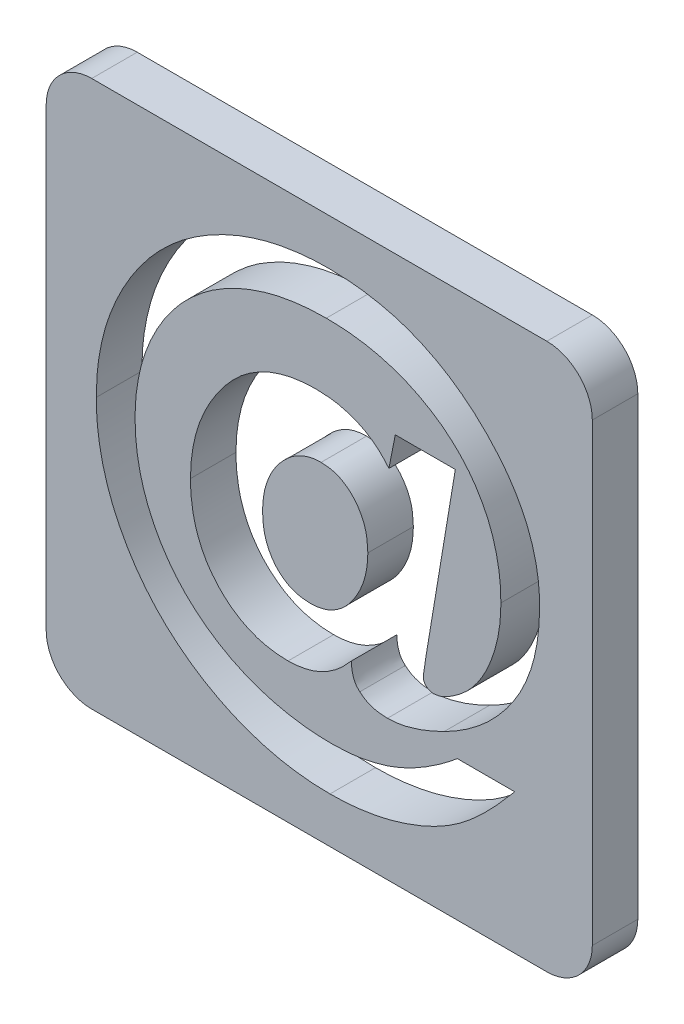
from build123d import *

# Parameters (mm, degrees)
BOSS_EXTRUDE1_DEPTH = 10
CUT_EXTRUDE10_DEPTH = 10


with BuildPart() as part:
    # Sketch1 → Boss-Extrude1 (new body)
    with BuildSketch(Plane.XY):
        with BuildLine():
            Line((-50, 60), (50, 60))
            ThreePointArc((50, 60), (57.071067812, 57.071067812), (60, 50))
            Line((60, 50), (60, -50))
            ThreePointArc((60, -50), (57.071067812, -57.071067812), (50, -60))
            Line((50, -60), (-50, -60))
            ThreePointArc((-50, -60), (-57.071067812, -57.071067812), (-60, -50))
            Line((-60, -50), (-60, 50))
            ThreePointArc((-60, 50), (-57.071067812, 57.071067812), (-50, 60))
        make_face()
    extrude(amount=BOSS_EXTRUDE1_DEPTH)

    # Sketch2 → Cut-Extrude10 (cut)
    with BuildSketch(Plane.XY.offset(10)):
        with BuildLine():
            Line((30.356971154, -29.262820513), (42.955128205, -29.262820513))
            add(Edge.make_bspline(
                [(42.955128205, -29.262820513), (42.373446421, -29.949540151), (41.239829282, -31.287861503), (39.552145379, -33.215585943), (37.896436193, -34.980855919), (36.293197749, -36.607698439), (34.739663205, -38.088091808), (33.237221895, -39.423483328), (31.784001414, -40.611768053), (29.909456797, -42.008423575), (27.472158927, -43.556935832), (24.376425538, -45.194771027), (21.039071675, -46.597464946), (17.526240437, -47.808913936), (13.858856748, -48.785692698), (10.089570788, -49.455553758), (6.249616527, -49.898554951), (3.664834233, -49.944707211), (2.36318109, -49.967948718)],
                knots=[0, 0, 0, 0, 0.912106962, 1.777569995, 2.59630641, 3.364595681, 4.09218467, 4.770774812, 5.401344362, 5.994106515, 7.139051617, 8.323895876, 9.539509699, 10.804118058, 12.087510927, 13.381328277, 14.681280706, 16, 16, 16, 16], degree=3))
            add(Edge.make_bspline(
                [(2.36318109, -49.967948718), (1.207733332, -49.953835497), (-1.082481672, -49.925861658), (-4.480018269, -49.574869509), (-7.816321327, -49.083617296), (-11.082692068, -48.318143392), (-14.298518253, -47.400180056), (-17.448802543, -46.247313219), (-20.535283631, -44.900675864), (-23.531672791, -43.331594081), (-26.439228829, -41.621920677), (-29.173998855, -39.709745879), (-31.758819002, -37.66842496), (-34.179359571, -35.47340351), (-36.450519905, -33.13438499), (-38.54595599, -30.627950523), (-40.493492114, -27.983056887), (-42.253064202, -25.193062831), (-43.830377942, -22.298603421), (-45.226897498, -19.337372672), (-46.389676146, -16.294647683), (-47.341500946, -13.191443693), (-48.083834276, -10.025081029), (-48.622416612, -6.803158061), (-48.92546684, -3.51410782), (-48.974996609, -1.30133612), (-49, -0.184294872)],
                knots=[0, 0, 0, 0, 1.044838649, 2.070976499, 3.087132743, 4.093650166, 5.103434239, 6.1109818, 7.126019313, 8.147573546, 9.169160017, 10.175251997, 11.163809779, 12.147022884, 13.129163562, 14.110817912, 15.100224835, 16.098462891, 17.092320042, 18.0807279, 19.0580281, 20.03645652, 21.015019567, 21.998081932, 22.989400915, 24, 24, 24, 24], degree=3))
            add(Edge.make_bspline(
                [(-49, -0.184294872), (-48.974593136, 0.93905868), (-48.923976198, 3.177064731), (-48.623829571, 6.504275152), (-48.084101319, 9.770569136), (-47.340256195, 12.974227478), (-46.392520388, 16.125877397), (-45.202851846, 19.201633727), (-43.830697534, 22.233602114), (-42.23406886, 25.175228117), (-40.482514589, 28.031074904), (-38.524661645, 30.708256428), (-36.45838075, 33.259389204), (-34.204217584, 35.61077389), (-31.814141011, 37.817548187), (-29.264205802, 39.853287534), (-26.549157324, 41.718506728), (-23.706543385, 43.431496214), (-20.737405526, 44.942374913), (-17.697200434, 46.292682282), (-14.560920603, 47.374140609), (-11.377420628, 48.336585452), (-8.101125561, 49.019475302), (-4.767729682, 49.540943316), (-1.360152744, 49.854652806), (0.935251202, 49.887317436), (2.096754808, 49.903846154)],
                knots=[0, 0, 0, 0, 1.014317886, 2.020779267, 3.013193412, 4.000969308, 4.988413066, 5.981867833, 6.976312655, 7.991067026, 9.001886247, 9.998588011, 10.983453909, 11.963813152, 12.936614909, 13.918729197, 14.906886913, 15.908758709, 16.912854418, 17.913087829, 18.909378123, 19.90616216, 20.913796156, 21.92793616, 22.95150933, 24, 24, 24, 24], degree=3))
            add(Edge.make_bspline(
                [(2.096754808, 49.903846154), (3.691040978, 49.870958989), (6.8274845, 49.806259981), (11.428404045, 49.186302337), (15.84875448, 48.25287832), (20.076890196, 46.895277225), (24.111080291, 45.128207917), (27.96707958, 42.99833074), (31.618643908, 40.464939352), (35.036425735, 37.594243282), (38.139680911, 34.458611109), (40.911142114, 31.190635894), (43.222063128, 27.754985639), (45.14955773, 24.209303948), (46.617264734, 20.512991333), (47.669578428, 16.698230981), (48.317949335, 12.759542482), (48.396354227, 10.088244527), (48.435897436, 8.740985577)],
                knots=[0, 0, 0, 0, 1.112384749, 2.188397543, 3.235022914, 4.262941595, 5.282268234, 6.305080615, 7.33321866, 8.379881503, 9.41633992, 10.409701185, 11.36648018, 12.301637889, 13.221808093, 14.136077516, 15.059937794, 16, 16, 16, 16], degree=3))
            add(Edge.make_bspline(
                [(48.435897436, 8.740985577), (48.416785729, 7.757135153), (48.379108097, 5.817530567), (48.105778599, 2.957065354), (47.671875611, 0.197755665), (47.069632723, -2.458547238), (46.261439008, -4.999675909), (45.28833971, -7.441521774), (44.154129548, -9.79282557), (42.808605332, -12.008914164), (41.351452096, -14.128011847), (39.735432899, -16.113877764), (38.012771484, -17.994731489), (36.154098509, -19.761646179), (34.161442941, -21.385188532), (32.04482893, -22.903159701), (29.813966909, -24.313972269), (28.237974722, -25.137620351), (27.4453125, -25.551883013)],
                knots=[0, 0, 0, 0, 1.11071627, 2.189713314, 3.241213933, 4.262798775, 5.261737586, 6.248587015, 7.22876036, 8.205263417, 9.172821461, 10.130306884, 11.093401214, 12.050913425, 13.022993843, 13.992961155, 14.990538226, 16, 16, 16, 16], degree=3))
            add(Edge.make_bspline(
                [(27.4453125, -25.551883013), (26.839569443, -25.85086053), (25.665223321, -26.430484324), (23.906434123, -27.154893816), (22.25120751, -27.828892689), (20.646923768, -28.325830622), (19.130349221, -28.763378907), (17.677658059, -29.042676288), (16.304586165, -29.22721984), (15.412268815, -29.251209174), (14.98036859, -29.262820513)],
                knots=[0, 0, 0, 0, 1.235872996, 2.395970773, 3.480405153, 4.504758683, 5.468013059, 6.367370585, 7.209773281, 8, 8, 8, 8], degree=3))
            add(Edge.make_bspline(
                [(14.98036859, -29.262820513), (14.375634383, -29.236997091), (13.224162143, -29.187826806), (11.585719668, -28.823043447), (10.124358387, -28.203667274), (9.310680983, -27.574642053), (8.909655449, -27.264623397)],
                knots=[0, 0, 0, 0, 1.111040528, 2.115528298, 3.071227409, 4, 4, 4, 4], degree=3))
            add(Edge.make_bspline(
                [(8.909655449, -27.264623397), (8.631880566, -26.999086268), (8.052508476, -26.44523921), (7.499864198, -25.285881304), (7.138581841, -23.90482527), (7.065132489, -22.896768713), (7.025641026, -22.354767628)],
                knots=[0, 0, 0, 0, 0.84582962, 1.764198658, 2.79787821, 4, 4, 4, 4], degree=3))
            add(Edge.make_bspline(
                [(7.025641026, -22.354767628), (6.547451743, -22.903659401), (5.611826766, -23.977620844), (4.064483389, -25.391535872), (2.435062206, -26.582015226), (0.731322195, -27.558626495), (-1.051446683, -28.336463068), (-2.923211224, -28.856741592), (-4.86248256, -29.196367512), (-6.180045689, -29.240474706), (-6.84755609, -29.262820513)],
                knots=[0, 0, 0, 0, 1.088483012, 2.129725465, 3.128222847, 4.101736138, 5.062537219, 6.029831694, 7.00186351, 8, 8, 8, 8], degree=3))
            add(Edge.make_bspline(
                [(-6.84755609, -29.262820513), (-7.597687093, -29.249637297), (-9.07359628, -29.223698855), (-11.233681772, -28.866205782), (-13.318437945, -28.402244299), (-15.285775644, -27.654494306), (-17.175048478, -26.749467806), (-18.934451978, -25.587949292), (-20.634978584, -24.272918457), (-22.200922241, -22.736514131), (-23.615368496, -21.025237654), (-24.8950473, -19.195567864), (-25.936972927, -17.200400579), (-26.790709165, -15.074441939), (-27.486807165, -12.82470196), (-27.951960138, -10.425631439), (-28.242965899, -7.898864135), (-28.277349506, -6.167022105), (-28.294871795, -5.284455128)],
                knots=[0, 0, 0, 0, 0.996320099, 1.960294912, 2.905596313, 3.831732669, 4.752281366, 5.685917543, 6.629259612, 7.607596653, 8.595884673, 9.578648765, 10.57110437, 11.581503045, 12.622224914, 13.697585308, 14.826662513, 16, 16, 16, 16], degree=3))
            add(Edge.make_bspline(
                [(-28.294871795, -5.284455128), (-28.275094373, -4.300037135), (-28.235912521, -2.349766804), (-27.857046759, 0.533278694), (-27.268772822, 3.340012837), (-26.456027748, 6.071030724), (-25.376530802, 8.707775932), (-24.078181334, 11.26637127), (-22.548622567, 13.751692041), (-20.798485486, 16.125653861), (-18.857809611, 18.325474748), (-16.739963767, 20.271848551), (-14.438912181, 21.886160278), (-12.005489144, 23.246133265), (-9.401099882, 24.262857979), (-6.654489973, 25.017704293), (-3.746972748, 25.456072131), (-1.755194723, 25.514868011), (-0.738782051, 25.544871795)],
                knots=[0, 0, 0, 0, 1.025111528, 2.030889939, 3.023731756, 4.010572873, 4.994799368, 5.987861107, 6.996631301, 8.031579918, 9.056776652, 10.04856216, 11.020396719, 11.978745493, 12.945782063, 13.925338154, 14.941291368, 16, 16, 16, 16], degree=3))
            add(Edge.make_bspline(
                [(-0.738782051, 25.544871795), (0.093207187, 25.522112832), (1.719262355, 25.477632293), (4.087231927, 25.155246261), (6.320716121, 24.599797915), (8.414807552, 23.820900762), (10.378492942, 22.823302786), (12.193935993, 21.604921992), (13.853723959, 20.141126513), (14.815697948, 19.016995236), (15.303886218, 18.446514423)],
                knots=[0, 0, 0, 0, 1.098159564, 2.14626338, 3.147557258, 4.130615999, 5.089370286, 6.048599882, 7.009691885, 8, 8, 8, 8], degree=3))
            Line((15.303886218, 18.446514423), (16.712139423, 25.544871795))
            Line((16.712139423, 25.544871795), (29.900240385, 25.544871795))
            Line((29.900240385, 25.544871795), (23.506009615, -12.915665064))
            add(Edge.make_bspline(
                [(23.506009615, -12.915665064), (23.406167591, -13.523997232), (23.231631556, -14.587436057), (23.061758243, -15.968373196), (22.900487581, -16.896262984), (22.86962385, -17.37490819), (22.858974359, -17.540064103)],
                knots=[0, 0, 0, 0, 1.583583446, 2.768297005, 3.575002465, 4, 4, 4, 4], degree=3))
            add(Edge.make_bspline(
                [(22.858974359, -17.540064103), (22.896536946, -17.783036799), (22.97632109, -18.299118618), (23.517501556, -18.934881255), (24.238896709, -19.43790174), (24.830023489, -19.492242997), (25.123597756, -19.519230769)],
                knots=[0, 0, 0, 0, 0.88088808, 1.871034604, 2.942681205, 4, 4, 4, 4], degree=3))
            add(Edge.make_bspline(
                [(25.123597756, -19.519230769), (25.54044506, -19.474693245), (26.46929736, -19.375451194), (27.913562595, -18.737181629), (29.518477248, -17.742727907), (31.309850002, -16.437750777), (33.118484465, -14.753243457), (34.769266257, -12.671436757), (36.27023876, -10.27104103), (37.530192996, -7.546346631), (38.603782419, -4.598302261), (39.352614476, -1.469865352), (39.828088648, 1.792956258), (39.882530322, 4.013401219), (39.91025641, 5.144230769)],
                knots=[0, 0, 0, 0, 0.485661064, 1.082188592, 1.81421814, 2.685658827, 3.657430019, 4.681580438, 5.769658718, 6.94567912, 8.169690259, 9.416304784, 10.68417414, 12, 12, 12, 12], degree=3))
            add(Edge.make_bspline(
                [(39.91025641, 5.144230769), (39.89373221, 5.988228351), (39.861129886, 7.653439576), (39.659623007, 10.116166419), (39.269309015, 12.497163553), (38.756201166, 14.804008973), (38.115044995, 17.048856625), (37.291689432, 19.205706483), (36.341126172, 21.296237875), (35.228715427, 23.292734202), (34.001909952, 25.215526521), (32.626009795, 27.022568431), (31.126292511, 28.733672958), (29.504616683, 30.34419898), (27.735261984, 31.827557998), (25.869091979, 33.235765223), (23.843855617, 34.495276809), (21.715055929, 35.681802329), (19.484250147, 36.737444297), (17.162767775, 37.669147593), (14.748415598, 38.40641895), (12.266273565, 39.073340283), (9.702202997, 39.559805298), (7.052041909, 39.900658304), (4.326770646, 40.113009209), (2.477743063, 40.144412715), (1.544871795, 40.16025641)],
                knots=[0, 0, 0, 0, 1.040927254, 2.053754399, 3.044065012, 4.013925682, 4.967078454, 5.920231225, 6.858369721, 7.796769119, 8.736374247, 9.668885693, 10.594678859, 11.540613114, 12.484182975, 13.44015668, 14.42115382, 15.422617935, 16.444408593, 17.462749525, 18.504382055, 19.555576815, 20.631087687, 21.719804181, 22.849595764, 24, 24, 24, 24], degree=3))
            add(Edge.make_bspline(
                [(1.544871795, 40.16025641), (0.561091636, 40.147427489), (-1.390627504, 40.121976221), (-4.275050308, 39.864607392), (-7.088941237, 39.463647174), (-9.825888553, 38.922396638), (-12.479903404, 38.191049686), (-15.05805319, 37.309830965), (-17.571925164, 36.294690928), (-19.983676372, 35.084230731), (-22.303952742, 33.761793584), (-24.505654281, 32.295911078), (-26.556003116, 30.66628886), (-28.507020222, 28.932113961), (-30.338488423, 27.073725007), (-32.015620944, 25.057710911), (-33.577328179, 22.921230367), (-35.024696966, 20.674001905), (-36.285190127, 18.309141158), (-37.424453663, 15.898871939), (-38.344590399, 13.408866993), (-39.14242345, 10.88061049), (-39.716692011, 8.27948376), (-40.170762927, 5.627051425), (-40.408828338, 2.909317124), (-40.452440068, 1.078438254), (-40.474358974, 0.158253205)],
                knots=[0, 0, 0, 0, 1.09139603, 2.165218013, 3.21044449, 4.244399487, 5.258712678, 6.262616842, 7.266496329, 8.264385998, 9.254449743, 10.228622201, 11.196032238, 12.158204111, 13.123845595, 14.088177805, 15.065244983, 16.059129694, 17.051218137, 18.036918468, 19.014821992, 19.994471931, 20.976319446, 21.968033256, 22.978749797, 24, 24, 24, 24], degree=3))
            add(Edge.make_bspline(
                [(-40.474358974, 0.158253205), (-40.452859917, -0.781016916), (-40.410225169, -2.643682123), (-40.167095497, -5.411123212), (-39.725471943, -8.112010754), (-39.118420746, -10.745083608), (-38.332237778, -13.306194554), (-37.383980867, -15.801016791), (-36.251263487, -18.226349798), (-34.966151098, -20.586025956), (-33.499785912, -22.832398862), (-31.92136323, -24.981586999), (-30.184463551, -26.986803631), (-28.289623242, -28.842672901), (-26.292147624, -30.611487388), (-24.13559391, -32.225134963), (-21.841515828, -33.709475295), (-19.432771062, -35.081403209), (-16.908276712, -36.295632987), (-14.291591571, -37.339537577), (-11.612465863, -38.238387926), (-8.851875458, -38.960470612), (-6.025419075, -39.534539615), (-3.113493248, -39.926658264), (-0.134565657, -40.186556767), (1.88051955, -40.21169195), (2.896033654, -40.224358974)],
                knots=[0, 0, 0, 0, 1.019428582, 2.021627332, 3.01190987, 3.987122772, 4.95180652, 5.917079598, 6.881099919, 7.854659174, 8.830406479, 9.790066312, 10.746585184, 11.705553405, 12.666594966, 13.640008177, 14.625277079, 15.630285463, 16.646361418, 17.662647236, 18.685811233, 19.711057421, 20.757373217, 21.813696226, 22.898199286, 24, 24, 24, 24], degree=3))
            add(Edge.make_bspline(
                [(2.896033654, -40.224358974), (4.09024291, -40.197278586), (6.45663689, -40.143617248), (9.947457263, -39.649165109), (13.340900508, -38.864785176), (16.68194361, -37.772898801), (20.020881705, -36.277159935), (23.405570259, -34.349298698), (26.911417652, -32.026750547), (29.178593785, -30.208083037), (30.356971154, -29.262820513)],
                knots=[0, 0, 0, 0, 0.947837634, 1.878194511, 2.79337344, 3.710878254, 4.664719902, 5.693133815, 6.800993507, 8, 8, 8, 8], degree=3))
        make_face()
        with BuildLine():
            add(Edge.make_bspline(
                [(-1.994791667, -15.865384615), (-1.549810033, -15.850804561), (-0.666596213, -15.821865601), (0.625742001, -15.589948731), (1.859539777, -15.205911627), (3.029518755, -14.667801118), (4.140582666, -13.975913557), (5.192274067, -13.130614971), (6.185248247, -12.133116915), (7.41586162, -10.614433574), (8.721397648, -8.52048407), (9.859983412, -5.803732736), (10.550257594, -2.920757891), (10.635915739, -0.942945969), (10.679487179, 0.063100962)],
                knots=[0, 0, 0, 0, 0.710514298, 1.410251571, 2.089736825, 2.769901828, 3.461668832, 4.17542767, 4.920648913, 5.705665255, 7.294358887, 8.843253591, 10.394268435, 12, 12, 12, 12], degree=3))
            add(Edge.make_bspline(
                [(10.679487179, 0.063100962), (10.642623794, 0.915778535), (10.571955674, 2.55038483), (10.040929958, 4.894874865), (9.090297817, 6.973141619), (7.816353979, 8.791805332), (6.264051639, 10.275807054), (4.491735891, 11.386462536), (2.501586556, 12.032758704), (1.111746684, 12.108708082), (0.403044872, 12.147435897)],
                knots=[0, 0, 0, 0, 1.154387065, 2.212991665, 3.231842362, 4.230536812, 5.202794393, 6.120739433, 7.041734666, 8, 8, 8, 8], degree=3))
            add(Edge.make_bspline(
                [(0.403044872, 12.147435897), (-0.022745702, 12.131312798), (-0.866745401, 12.099353679), (-2.108487627, 11.889627736), (-3.304782624, 11.524533495), (-4.451660627, 10.995516357), (-5.579747771, 10.357802292), (-6.644688189, 9.548471738), (-7.663515801, 8.598626664), (-8.965151282, 7.174815388), (-10.36953998, 5.156172232), (-11.580280688, 2.446324511), (-12.326732501, -0.512640023), (-12.415791746, -2.571327907), (-12.461538462, -3.62880609)],
                knots=[0, 0, 0, 0, 0.680663477, 1.349207348, 2.006816805, 2.674051842, 3.364615308, 4.074492284, 4.8064802, 5.588923708, 7.155813855, 8.712695607, 10.311423162, 12, 12, 12, 12], degree=3))
            add(Edge.make_bspline(
                [(-12.461538462, -3.62880609), (-12.424721562, -4.50686496), (-12.354078591, -6.19165339), (-11.824600509, -8.595447426), (-10.902033324, -10.719241253), (-9.640228227, -12.549320955), (-8.075243386, -14.033260284), (-6.245056647, -15.100208424), (-4.18902167, -15.758168102), (-2.741996468, -15.828873997), (-1.994791667, -15.865384615)],
                knots=[0, 0, 0, 0, 1.164968287, 2.235300111, 3.245807089, 4.219769162, 5.166866278, 6.083843216, 7.010548299, 8, 8, 8, 8], degree=3))
        make_face(mode=Mode.SUBTRACT)
    extrude(amount=-CUT_EXTRUDE10_DEPTH, mode=Mode.SUBTRACT)


with BuildPart() as cut_extrude10_piece_1:
    # of the separate pieces the step leaves, piece 1, a body of its own (cut_extrude10_pieces)
    add(part.part.solids().sort_by_distance((-50, 60, 0))[0])


with BuildPart() as cut_extrude10_piece_2:
    # of the separate pieces the step leaves, piece 2, a body of its own (cut_extrude10_pieces)
    add(part.part.solids().sort_by_distance((-1.994791667, -15.865384615, 0))[0])


solid = Compound([cut_extrude10_piece_1.part, cut_extrude10_piece_2.part])
